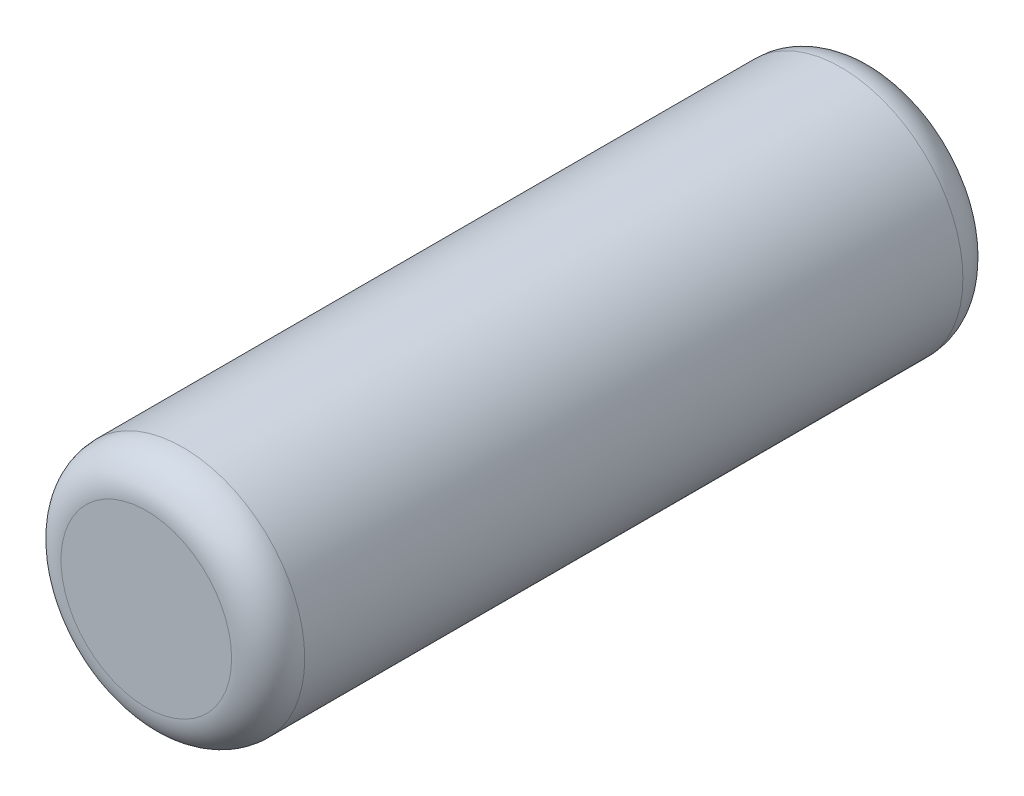
from build123d import *

# Parameters (mm, degrees)
SKETCH_1_R      = 1
EXTRUDE_1_DEPTH = 3
FILLET_1_R      = 0.3
FILLET_2_R      = 0.3


with BuildPart() as part:
    # 草图1 → 拉伸1 (new, symmetric)
    with BuildSketch(Plane.XY):
        Circle(SKETCH_1_R)
    extrude(amount=EXTRUDE_1_DEPTH, both=True)

    # 圆角1
    fillet_1_edges = [part.edges().sort_by_distance(p)[0] for p in [
        (-1, 0, 3),
    ]]
    fillet(fillet_1_edges, radius=FILLET_1_R)

    # 圆角2
    fillet_2_edges = [part.edges().sort_by_distance(p)[0] for p in [
        (-1, 0, -3),
    ]]
    fillet(fillet_2_edges, radius=FILLET_2_R)


solid = part.part
